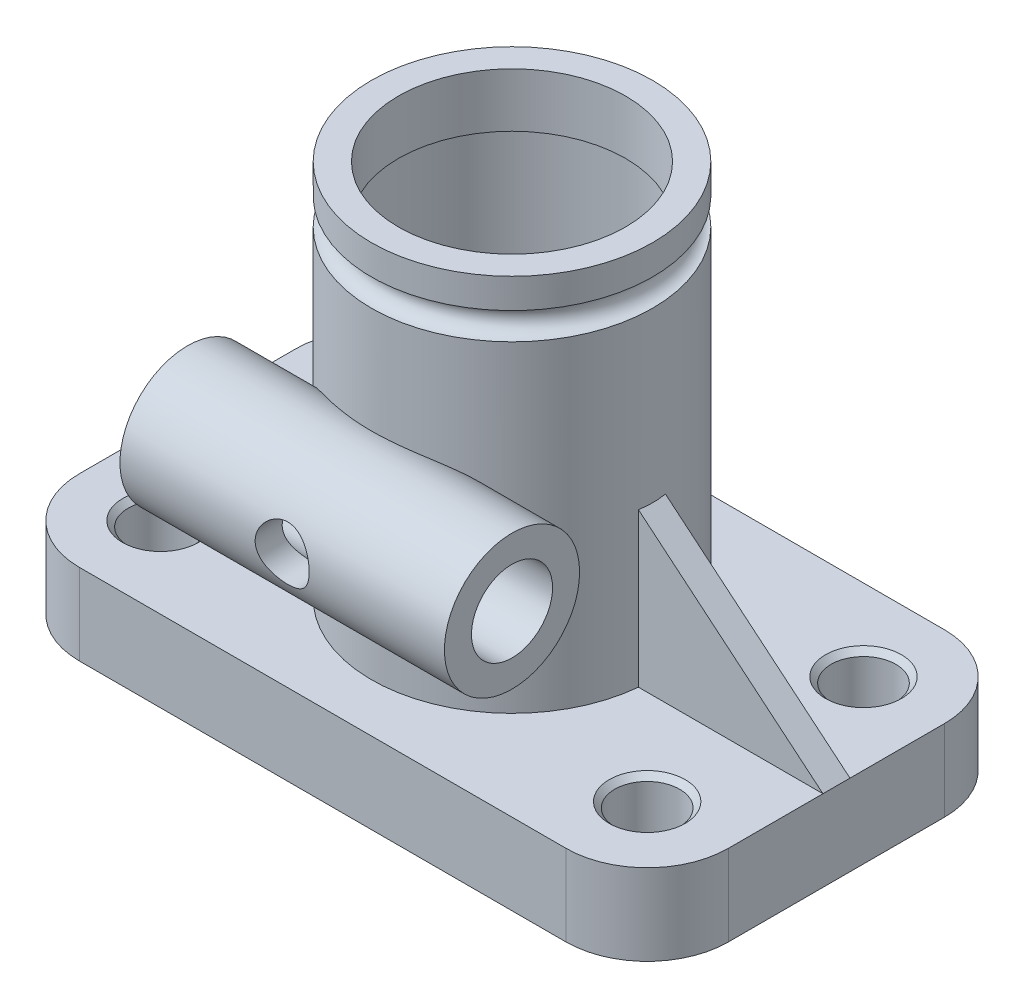
from build123d import *

# Parameters (mm, degrees)
SKETCH1_W                    = 120
SKETCH1_H                    = 70
BOSS_EXTRUDE1_DEPTH          = 15
SKETCH2_R                    = 26
BOSS_EXTRUDE2_DEPTH          = 70
SKETCH8_R                    = 2.5
BOSS_EXTRUDE3_DEPTH          = 2.5
SKETCH10_R                   = 12.5
BOSS_EXTRUDE4_DEPTH          = 60
SKETCH11_R                   = 23
CUT_EXTRUDE1_DEPTH           = 60
HOLE2_D                      = 15
SKETCH14_R                   = 5
CUT_EXTRUDE2_DEPTH           = 60
FILLET1_R                    = 15
M14_TAPPED_HOLE1_D           = 12
M14_TAPPED_HOLE1_CSINK_D     = 14.05
M14_TAPPED_HOLE1_CSINK_ANGLE = 90


with BuildPart() as part:
    # Sketch1 → Boss-Extrude1 (new body)
    with BuildSketch(Plane(origin=(0, 0, 0), x_dir=(1, 0, 0), z_dir=(0, 1, 0))):
        Rectangle(SKETCH1_W, SKETCH1_H)
    extrude(amount=BOSS_EXTRUDE1_DEPTH)

    # Sketch2 → Boss-Extrude2 (add)
    with BuildSketch(Plane(origin=(0, 15, 0), x_dir=(1, 0, 0), z_dir=(0, 1, 0))):
        with Locations(Location((0, 0, 0), (0, 0, 270))):
            Circle(SKETCH2_R)
    extrude(amount=BOSS_EXTRUDE2_DEPTH)

    # Sketch7 → Cut-Revolve2 (revolve, cut)
    with BuildSketch(Plane.XY, mode=Mode.PRIVATE) as cut_revolve2_sk:
        Polygon((0, 0), (0, 85), (21, 85), (21, 65), (23, 65), (23, 15), (15, 15), (15, 10), (12, 10), (12, 0), align=None)
    revolve(cut_revolve2_sk.sketch.rotate(Axis((0, 0, 0), (0, 1, 0)), 90), axis=Axis((0, 0, 0), (0, 1, 0)), mode=Mode.SUBTRACT)

    # Sketch8 → Cut-Revolve3 (revolve, cut)
    with BuildSketch(Plane.XY, mode=Mode.PRIVATE) as cut_revolve3_sk:
        with Locations((26, 77)):
            Circle(SKETCH8_R)
    revolve(cut_revolve3_sk.sketch.rotate(Axis((0, 0, 0), (0, 1, 0)), 90), axis=Axis((0, 0, 0), (0, 1, 0)), mode=Mode.SUBTRACT)

    # Sketch9 → Boss-Extrude3 (add, symmetric)
    with BuildSketch(Plane.XY):
        Polygon((24, 45), (60, 15), (24, 15), align=None)
    extrude(amount=BOSS_EXTRUDE3_DEPTH, both=True)

    # Sketch10 → Boss-Extrude4 (add)
    with BuildSketch(Plane(origin=(30, 0, 0), x_dir=(0, 0, -1), z_dir=(1, 0, 0))):
        with Locations((-30, 43)):
            Circle(SKETCH10_R)
    extrude(amount=-BOSS_EXTRUDE4_DEPTH)

    # Sketch11 → Cut-Extrude1 (cut)
    with BuildSketch(Plane(origin=(0, 15, 0), x_dir=(1, 0, 0), z_dir=(0, 1, 0))):
        with Locations(Location((0, 0, 0), (0, 0, 90))):
            Circle(SKETCH11_R)
    extrude(amount=CUT_EXTRUDE1_DEPTH, mode=Mode.SUBTRACT)

    # Hole2 (through all)
    with Locations(Plane(origin=(30, 0, 0), x_dir=(0, 0, -1), z_dir=(1, 0, 0))):
        with Locations((-30, 43)):
            Hole(HOLE2_D / 2)

    # Sketch14 → Cut-Extrude2 (cut)
    with BuildSketch(Plane.XY):
        with Locations(Location((0, 43, 0), (0, 0, 180))):
            Circle(SKETCH14_R)
    extrude(amount=CUT_EXTRUDE2_DEPTH, mode=Mode.SUBTRACT)

    # Fillet1
    fillet1_edges = [part.edges().sort_by_distance(p)[0] for p in [
        (-60, 7.5, -35),
        (60, 7.5, -35),
        (60, 7.5, 35),
        (-60, 7.5, 35),
    ]]
    fillet(fillet1_edges, radius=FILLET1_R)

    # M14 Tapped Hole1 (through all)
    with Locations(Plane(origin=(0, 15, 0), x_dir=(1, 0, 0), z_dir=(0, 1, 0))):
        with Locations((45, -20), (45, 20), (-45, 20), (-45, -20)):
            CounterSinkHole(M14_TAPPED_HOLE1_D / 2, M14_TAPPED_HOLE1_CSINK_D / 2, counter_sink_angle=M14_TAPPED_HOLE1_CSINK_ANGLE)


solid = part.part
